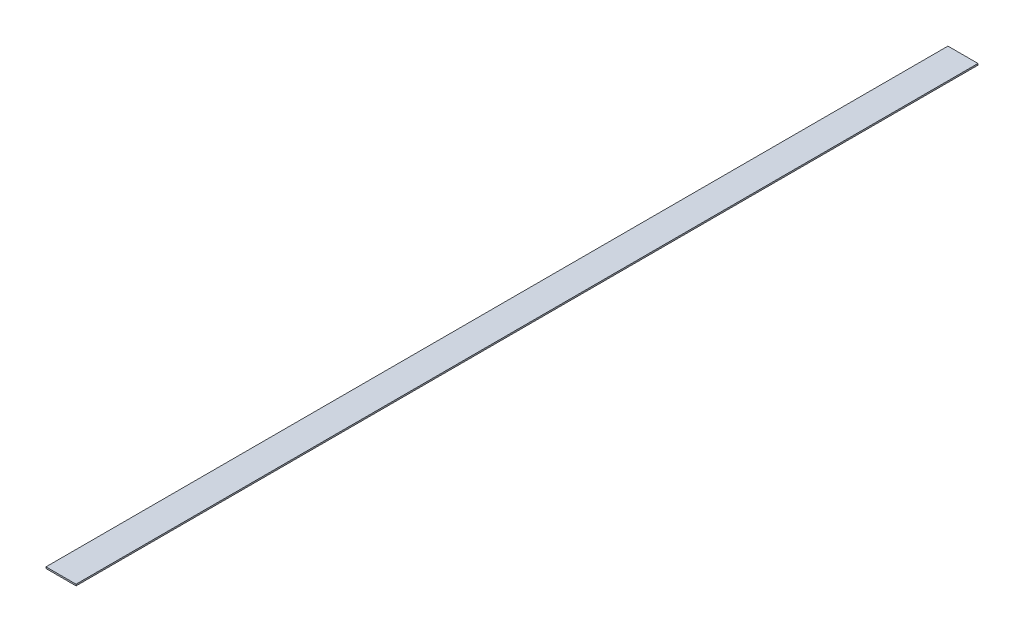
from build123d import *

# Parameters (mm, degrees)
SKETCH1_W           = 4
SKETCH1_H           = 120
BOSS_EXTRUDE1_DEPTH = 0.2


with BuildPart() as part:
    # Sketch1 → Boss-Extrude1 (new body)
    with BuildSketch(Plane(origin=(0, 0, 0), x_dir=(1, 0, 0), z_dir=(0, 1, 0))):
        Rectangle(SKETCH1_W, SKETCH1_H)
    extrude(amount=BOSS_EXTRUDE1_DEPTH)


solid = part.part
